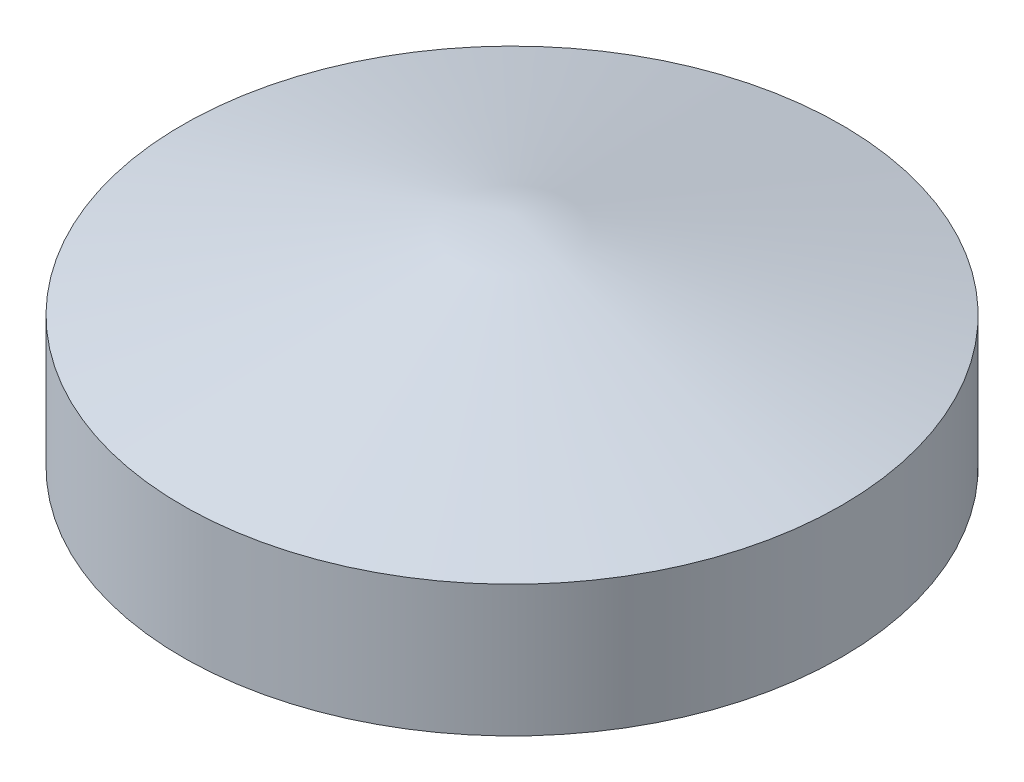
from build123d import *


with BuildPart() as part:
    # Эскиз1 → Повернуть1 (revolve)
    with BuildSketch(Plane.XY, mode=Mode.PRIVATE) as revolve_1_sk:
        Polygon((-9, -2.411542732), (-9, 1.176914536), (0, 3.588457268), (0, 0), align=None)
    revolve(revolve_1_sk.sketch.rotate(Axis((0, 0, 0), (0, 1, 0)), 180), axis=Axis((0, 0, 0), (0, 1, 0)))


solid = part.part
